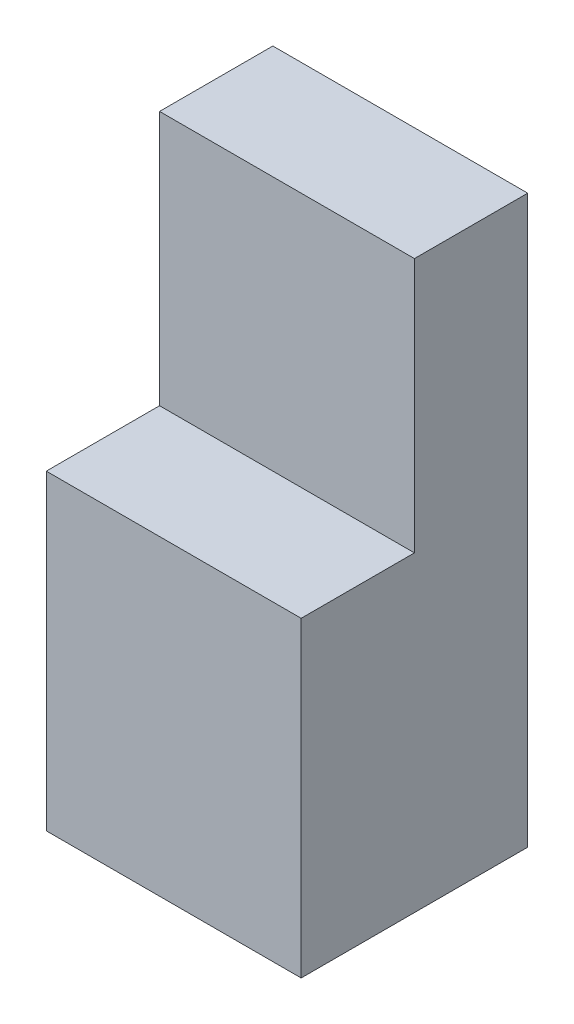
from build123d import *

# Parameters (mm, degrees)
SKETCH1_W           = 18
SKETCH1_H           = 40
BOSS_EXTRUDE1_DEPTH = 8
SKETCH2_W           = 18
SKETCH2_H           = 22
BOSS_EXTRUDE2_DEPTH = 8


with BuildPart() as part:
    # Sketch1 → Boss-Extrude1 (new body)
    with BuildSketch(Plane.XY):
        Rectangle(SKETCH1_W, SKETCH1_H)
    extrude(amount=BOSS_EXTRUDE1_DEPTH)

    # Sketch2 → Boss-Extrude2 (add)
    with BuildSketch(Plane.XY.offset(8)):
        with Locations((0, -9)):
            Rectangle(SKETCH2_W, SKETCH2_H)
    extrude(amount=BOSS_EXTRUDE2_DEPTH)


solid = part.part
